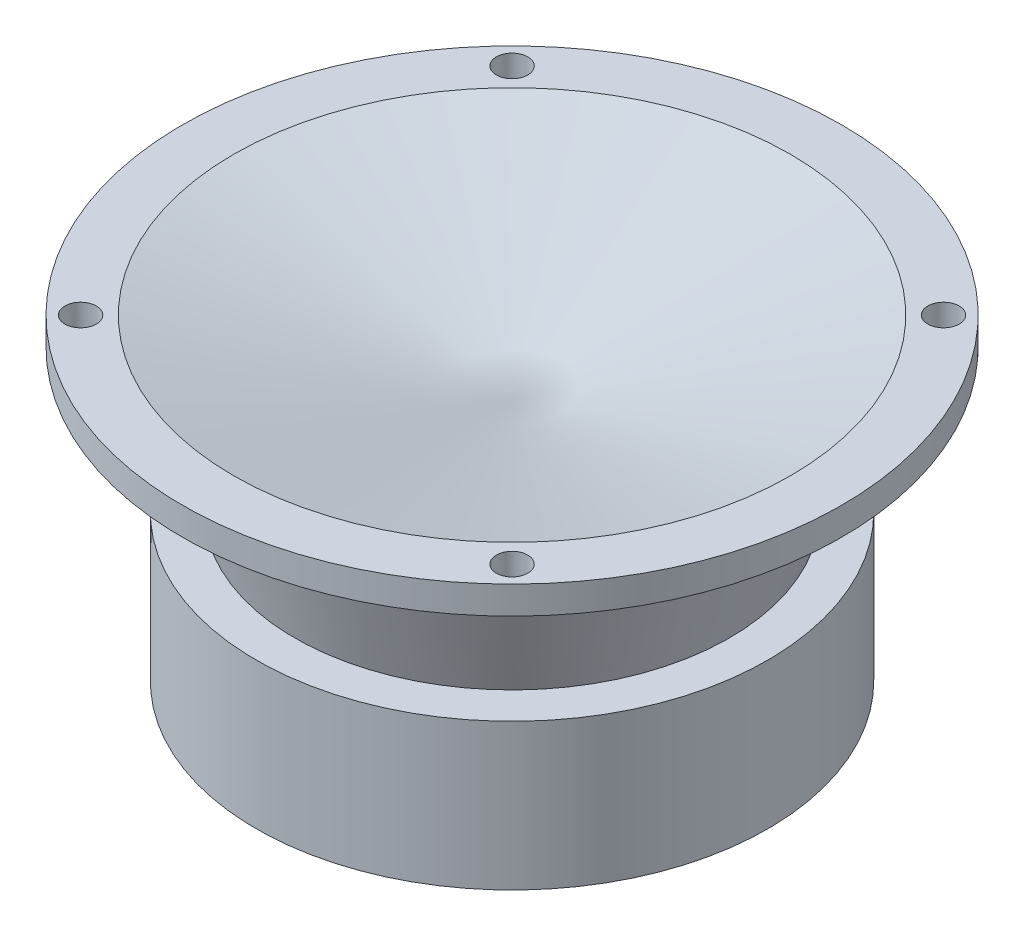
from build123d import *

# Parameters (mm, degrees)
SKETCH4_W                  = 6.566002255
SKETCH4_H                  = 24
BOSS_EXTRUDE1_DEPTH        = 17.5
F_4_3_4_3_DIAMETER_HOLE1_D = 4.3


with BuildPart() as part:
    # Sketch1 → Revolve1 (revolve)
    with BuildSketch(Plane.XY, mode=Mode.PRIVATE) as revolve1_sk:
        Polygon((0, 33.191135768), (38.1, 43.4), (45.1, 43.4), (45.1, 39.6), (35, 39.6), (29.748195828, 20), (35, 20), (35, 0), (0, 0), align=None)
    revolve(revolve1_sk.sketch.rotate(Axis((0, 0, 0), (0, 1, 0)), 90), axis=Axis((0, 0, 0), (0, 1, 0)))

    # Sketch4 → Boss-Extrude1 (add)
    with BuildSketch(Plane.XZ.offset(-39.6)):
        with Locations((-34.716998872, 0)):
            Rectangle(SKETCH4_W, SKETCH4_H)
    extrude(amount=BOSS_EXTRUDE1_DEPTH)

    # Ø4.3 (4.3) Diameter Hole1 (through all)
    with Locations(Plane(origin=(0, 43.4, 0), x_dir=(1, 0, 0), z_dir=(0, 1, 0))):
        with Locations((-29.521708115, -29.521708115), (-29.521708115, 29.521708115), (29.521708115, 29.521708115), (29.521708115, -29.521708115)):
            Hole(F_4_3_4_3_DIAMETER_HOLE1_D / 2)


solid = part.part
